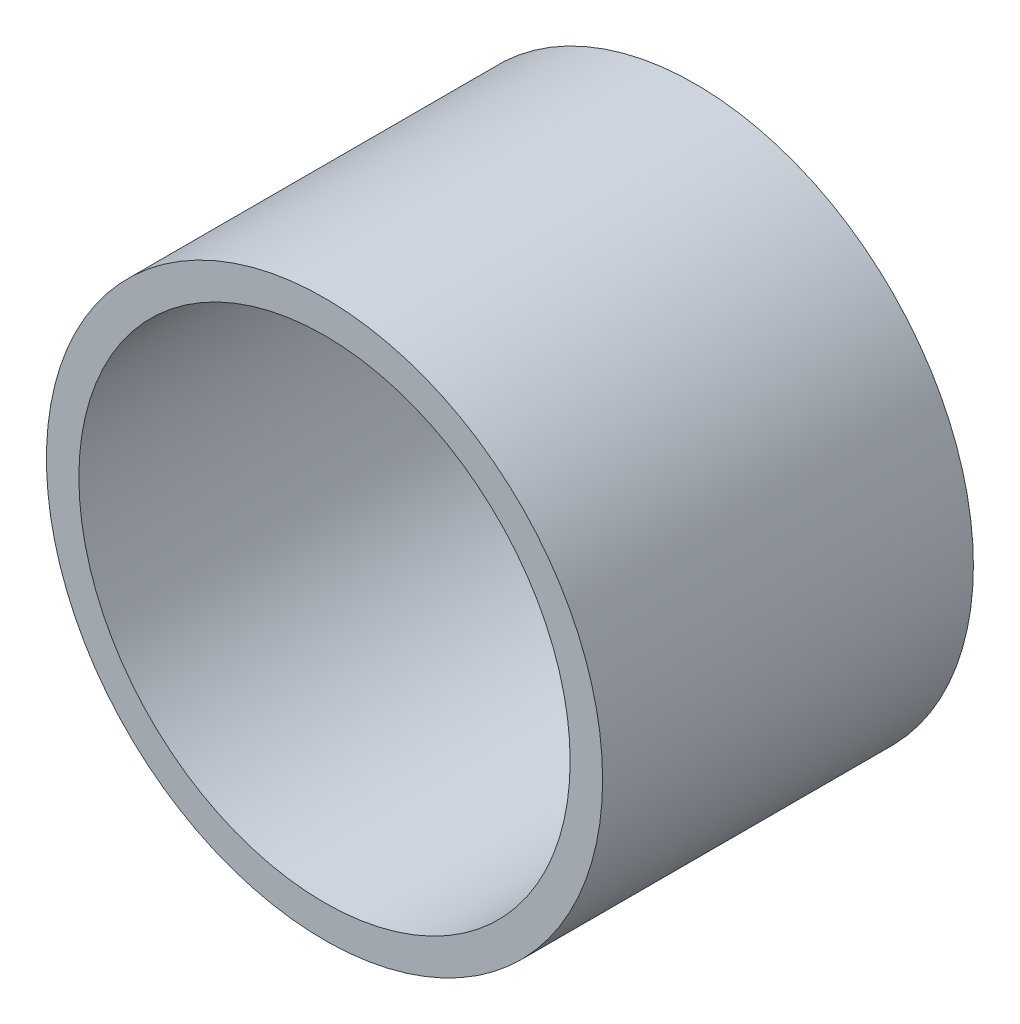
from build123d import *

# Parameters (mm, degrees)
CROQUIS1_R              = 6
SALIENTE_EXTRUIR1_DEPTH = 8
CROQUIS2_R              = 5.3
CORTAR_EXTRUIR1_DEPTH   = 8


with BuildPart() as part:
    # Croquis1 → Saliente-Extruir1 (new body)
    with BuildSketch(Plane.XY):
        Circle(CROQUIS1_R)
    extrude(amount=SALIENTE_EXTRUIR1_DEPTH)

    # Croquis2 → Cortar-Extruir1 (cut)
    with BuildSketch(Plane.XY):
        Circle(CROQUIS2_R)
    extrude(amount=CORTAR_EXTRUIR1_DEPTH, mode=Mode.SUBTRACT)


solid = part.part
